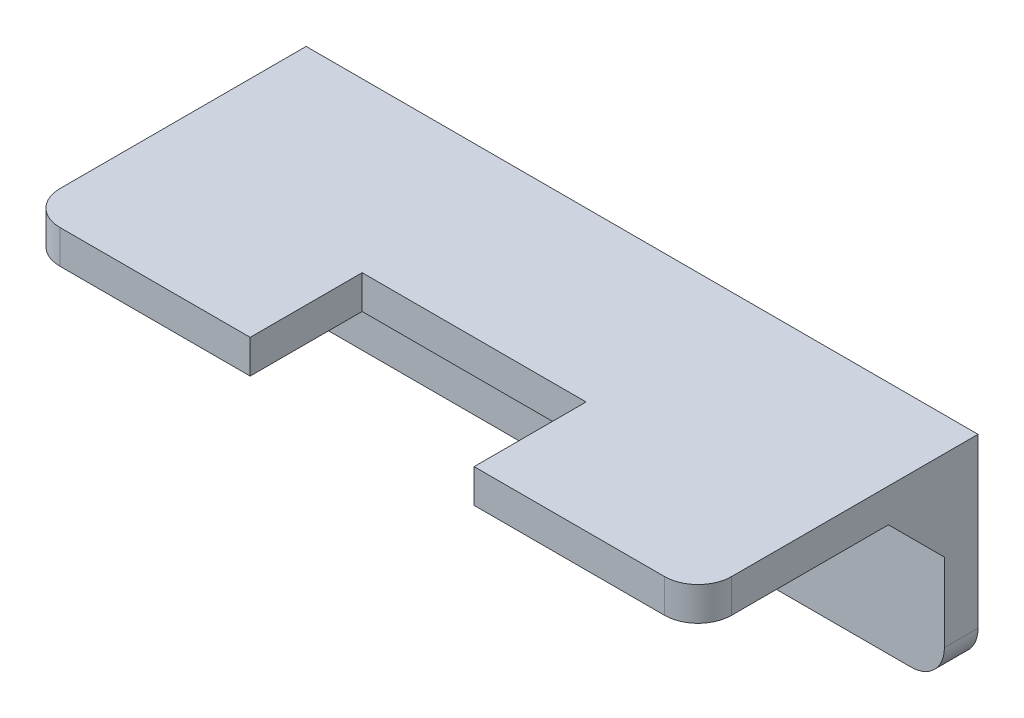
from build123d import *

# Parameters (mm, degrees)
SKETCH1_W           = 60
SKETCH1_H           = 3
BOSS_EXTRUDE1_DEPTH = 25
SKETCH2_W           = 60
SKETCH2_H           = 3
BOSS_EXTRUDE2_DEPTH = 15
SKETCH3_W           = 20
SKETCH3_H           = 10
CUT_EXTRUDE1_DEPTH  = 42.833001327
FILLET1_R           = 3
CHAMFER1_SIZE       = 5


with BuildPart() as part:
    # Sketch1 → Boss-Extrude1 (new body)
    with BuildSketch(Plane.XY):
        with Locations((0, 158.5)):
            Rectangle(SKETCH1_W, SKETCH1_H)
    extrude(amount=BOSS_EXTRUDE1_DEPTH)

    # Sketch2 → Boss-Extrude2 (add)
    with BuildSketch(Plane.XZ.offset(-157)):
        with Locations((0, 1.5)):
            Rectangle(SKETCH2_W, SKETCH2_H)
    extrude(amount=BOSS_EXTRUDE2_DEPTH)

    # Sketch3 → Cut-Extrude1 (cut, through all)
    with BuildSketch(Plane.XZ.offset(-157)):
        with Locations((0, 20)):
            Rectangle(SKETCH3_W, SKETCH3_H)
    extrude(amount=-CUT_EXTRUDE1_DEPTH, mode=Mode.SUBTRACT)

    # Fillet1
    fillet1_edges = [part.edges().sort_by_distance(p)[0] for p in [
        (30, 158.5, 25),
        (-30, 142, 1.5),
        (30, 142, 1.5),
        (-30, 158.5, 25),
    ]]
    fillet(fillet1_edges, radius=FILLET1_R)

    # Chamfer1
    chamfer1_edges = [part.edges().sort_by_distance(p)[0] for p in [
        (0, 157, 3),
    ]]
    chamfer(chamfer1_edges, length=CHAMFER1_SIZE)


solid = part.part
